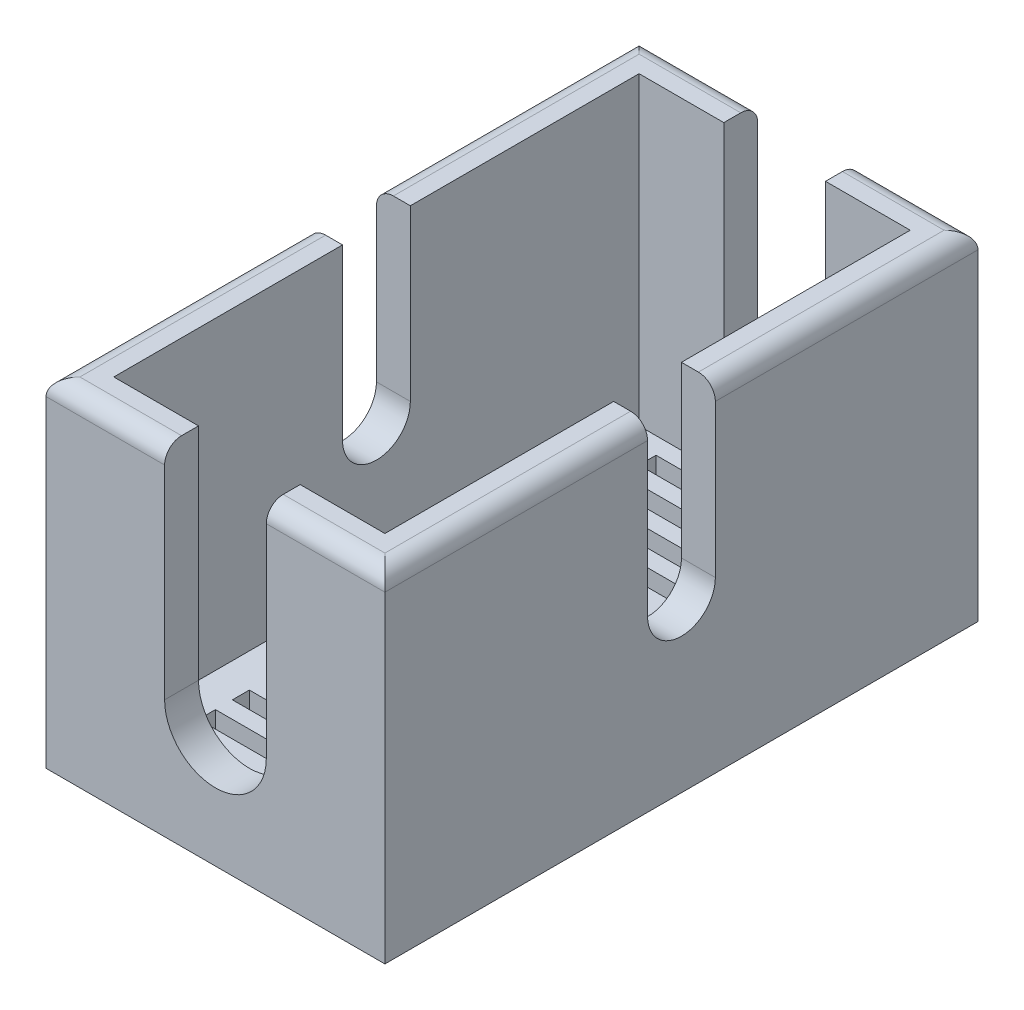
from build123d import *

# Parameters (mm, degrees)
SKIZZE1_W                                   = 20
SKIZZE1_H                                   = 20
AUFSATZ_LINEAR_AUSTRAGEN1_DEPTH             = 35
WANDUNG1_T                                  = -2
SCHNITT_LINEAR_AUSTRAGEN2_DEPTH             = 33
VERRUNDUNG1_R                               = 1
SKIZZE4_W                                   = 12
SKIZZE4_H                                   = 1
SCHNITT_LINEAR_AUSTRAGEN3_DEPTH             = 2
LINEARES_MUSTER1_COUNT                      = 8
LINEARES_MUSTER1_PITCH                      = 2
LINEARES_MUSTER1_COL_COUNT                  = 8
LINEARES_MUSTER1_COL_PITCH                  = 2
SKIZZE5_W                                   = 12
SKIZZE5_H                                   = 15
AUFSATZ_LINEAR_AUSTRAGEN2_DEPTH             = 2
SCHNITT_LINEAR_AUSTRAGEN4_REACH             = 46.147
SCHNITT_LINEAR_AUSTRAGEN4_DIRECTION_2_REACH = 46.147


with BuildPart() as part:
    # Skizze1 → Aufsatz-Linear austragen1 (new body)
    with BuildSketch(Plane.XY):
        with Locations((10, 10)):
            Rectangle(SKIZZE1_W, SKIZZE1_H)
    extrude(amount=AUFSATZ_LINEAR_AUSTRAGEN1_DEPTH)

    # Wandung1
    wandung1_openings = [part.faces().sort_by_distance(p)[0] for p in [
        (10, 20, 17.5),
    ]]
    offset(amount=WANDUNG1_T, openings=wandung1_openings, kind=Kind.INTERSECTION)

    # Skizze3 → Schnitt-Linear austragen2 (cut)
    with BuildSketch(Plane.XY.offset(35)):
        with BuildLine():
            Line((13, 20), (13, 7))
            ThreePointArc((13, 7), (10, 4), (7, 7))
            Line((7, 7), (7, 20))
            ThreePointArc((7, 20), (10, 23), (13, 20))
        make_face()
    schnitt_linear_austragen2 = extrude(amount=-SCHNITT_LINEAR_AUSTRAGEN2_DEPTH, mode=Mode.SUBTRACT)

    # Spiegeln1: Schnitt-Linear austragen2 across plane
    add(schnitt_linear_austragen2.mirror(Plane.XY.offset(17.5)), mode=Mode.SUBTRACT)

    # Verrundung1
    verrundung1_edges = [part.edges().sort_by_distance(p)[0] for p in [
        (16.5, 20, 35),
        (3.5, 20, 35),
        (3.5, 20, 0),
        (16.5, 20, 0),
        (0, 20, 17.5),
        (20, 20, 17.5),
    ]]
    fillet(verrundung1_edges, radius=VERRUNDUNG1_R)

    # Skizze4 → Schnitt-Linear austragen3 (cut)
    with BuildSketch(Plane(origin=(0, 2, 0), x_dir=(1, 0, 0), z_dir=(0, 1, 0))):
        with Locations((10, -17.5)):
            Rectangle(SKIZZE4_W, SKIZZE4_H)
    schnitt_linear_austragen3 = extrude(amount=-SCHNITT_LINEAR_AUSTRAGEN3_DEPTH, mode=Mode.SUBTRACT)

    # Lineares Muster1: Schnitt-Linear austragen3 ×8
    with Locations(*[(0, 0, i * LINEARES_MUSTER1_PITCH) for i in range(1, LINEARES_MUSTER1_COUNT)]):
        add(schnitt_linear_austragen3, mode=Mode.SUBTRACT)

    # Lineares Muster1 col: Schnitt-Linear austragen3 ×8
    with Locations(*[(0, 0, -i * LINEARES_MUSTER1_COL_PITCH) for i in range(1, LINEARES_MUSTER1_COL_COUNT)]):
        add(schnitt_linear_austragen3, mode=Mode.SUBTRACT)

    # Skizze5 → Aufsatz-Linear austragen2 (add)
    with BuildSketch(Plane.XZ):
        with Locations((10, 17.5)):
            Rectangle(SKIZZE5_W, SKIZZE5_H)
    extrude(amount=-AUFSATZ_LINEAR_AUSTRAGEN2_DEPTH)

    # Schnitt-Linear austragen4: up to this face of the body (flat: up to its plane)
    schnitt_linear_austragen4_end = Plane(part.part.faces().sort_by_distance((20, 9.5, 17.5))[0])
    # Skizze7 → Schnitt-Linear austragen4 (cut, up to the picked face)
    with BuildSketch(Plane.ZY.offset(-18), mode=Mode.PRIVATE) as schnitt_linear_austragen4_sk1:
        with BuildLine():
            Line((19.5, 30), (19.5, 10))
            ThreePointArc((19.5, 10), (17.5, 8), (15.5, 10))
            Line((15.5, 10), (15.5, 30))
            ThreePointArc((15.5, 30), (17.5, 32), (19.5, 30))
        make_face()
    schnitt_linear_austragen4_tool1 = split(extrude(schnitt_linear_austragen4_sk1.sketch, amount=-SCHNITT_LINEAR_AUSTRAGEN4_REACH, mode=Mode.PRIVATE), bisect_by=schnitt_linear_austragen4_end, keep=Keep.BOTH, mode=Mode.PRIVATE)
    add(schnitt_linear_austragen4_tool1.solids().sort_by(Axis((18, 20, 17.5), (1, 0, 0)))[0], mode=Mode.SUBTRACT)

    # Schnitt-Linear austragen4 direction 2: up to this face of the body (flat: up to its plane)
    schnitt_linear_austragen4_direction_2_end = Plane(part.part.faces().sort_by_distance((0, 9.5, 17.5))[0])
    # Skizze7 → Schnitt-Linear austragen4 direction 2 (cut, up to the picked face)
    with BuildSketch(Plane.ZY.offset(-18), mode=Mode.PRIVATE) as schnitt_linear_austragen4_direction_2_sk1:
        with BuildLine():
            Line((19.5, 30), (19.5, 10))
            ThreePointArc((19.5, 10), (17.5, 8), (15.5, 10))
            Line((15.5, 10), (15.5, 30))
            ThreePointArc((15.5, 30), (17.5, 32), (19.5, 30))
        make_face()
    schnitt_linear_austragen4_direction_2_tool1 = split(extrude(schnitt_linear_austragen4_direction_2_sk1.sketch, amount=SCHNITT_LINEAR_AUSTRAGEN4_DIRECTION_2_REACH, mode=Mode.PRIVATE), bisect_by=schnitt_linear_austragen4_direction_2_end, keep=Keep.BOTH, mode=Mode.PRIVATE)
    add(schnitt_linear_austragen4_direction_2_tool1.solids().sort_by(Axis((18, 20, 17.5), (-1, 0, 0)))[0], mode=Mode.SUBTRACT)


solid = part.part
